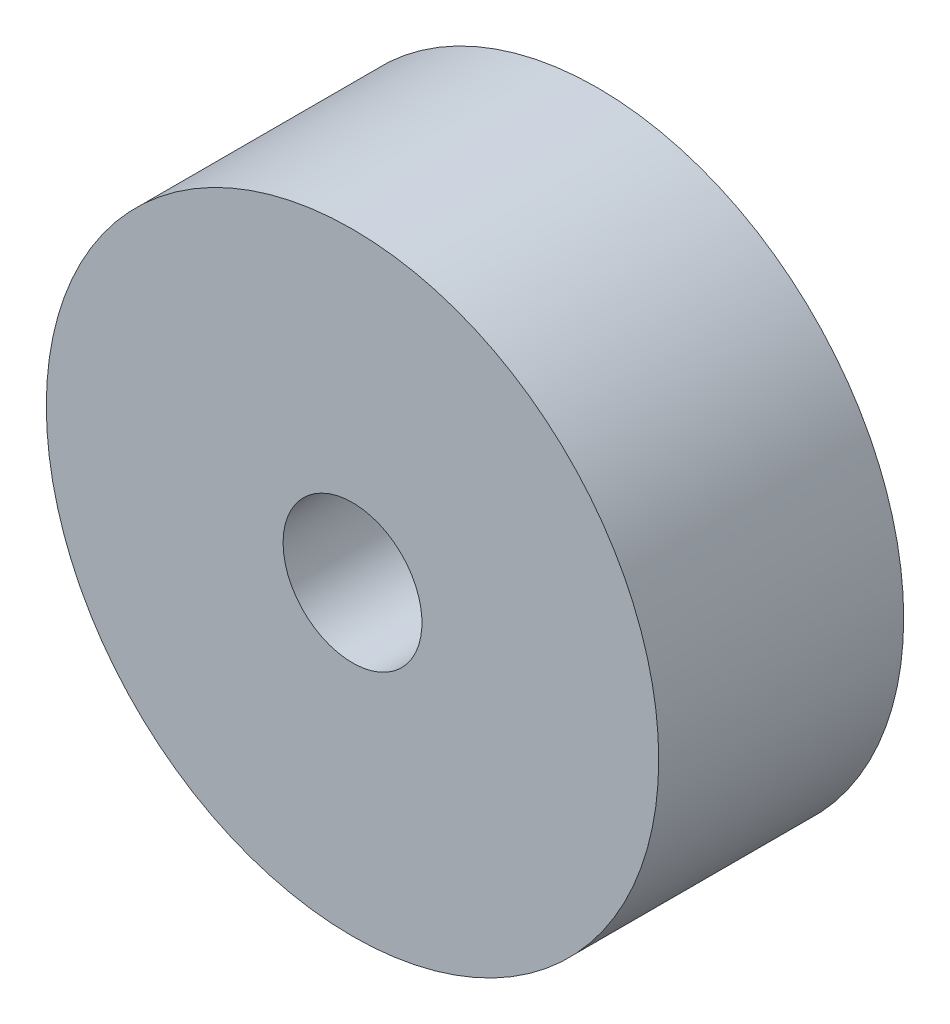
from build123d import *

# Parameters (mm, degrees)
SKETCH1_W = 2.70625
SKETCH1_H = 2.8


with BuildPart() as part:
    # Sketch1 → Revolve1 (revolve)
    with BuildSketch(Plane.XZ, mode=Mode.PRIVATE) as revolve1_sk:
        with Locations((2.146875, 1.4)):
            Rectangle(SKETCH1_W, SKETCH1_H)
    revolve(revolve1_sk.sketch.rotate(Axis((0, 0, 2.8), (0, 0, -1)), 180), axis=Axis((0, 0, 2.8), (0, 0, -1)))


solid = part.part
